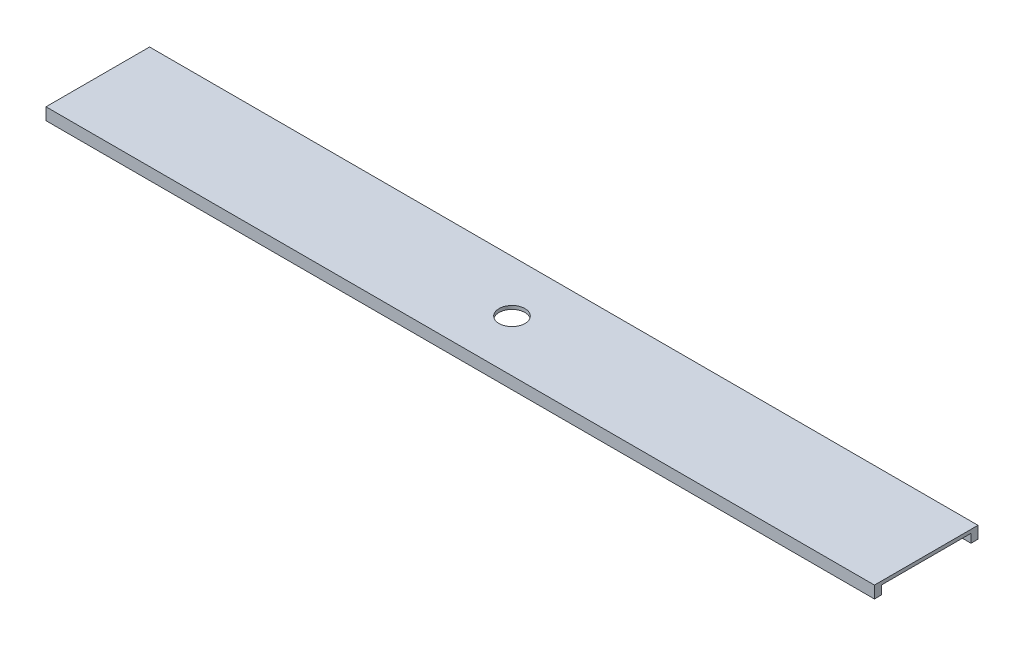
from build123d import *

# Parameters (mm, degrees)
SKETCH1_W               = 960
SKETCH1_H               = 120
BOSS_EXTRUDE1_DEPTH     = 4
CUT_EXTRUDE1_DEPTH      = 24
CUT_EXTRUDE1_DEPTH_BACK = 13
SKETCH2_R               = 15
SKETCH3_W               = 960
SKETCH3_H               = 8.349001696
BOSS_EXTRUDE2_DEPTH     = 10
SKETCH4_W               = 960
SKETCH4_H               = 8.113720408
BOSS_EXTRUDE3_DEPTH     = 10


with BuildPart() as part:
    # Sketch1 → Boss-Extrude1 (new body)
    with BuildSketch(Plane(origin=(0, 0, 0), x_dir=(1, 0, 0), z_dir=(0, 1, 0))):
        Rectangle(SKETCH1_W, SKETCH1_H)
    extrude(amount=BOSS_EXTRUDE1_DEPTH)

    # Sketch2 → Cut-Extrude1 (cut, two sides: drawn at the far end of the back side and taken through both)
    with BuildSketch(Plane(origin=(0, 4, 0), x_dir=(1, 0, 0), z_dir=(0, 1, 0)).offset(-CUT_EXTRUDE1_DEPTH_BACK)):
        with Locations(Location((0, 0, 0), (0, 0, 270))):
            Circle(SKETCH2_R)
    extrude(amount=CUT_EXTRUDE1_DEPTH + CUT_EXTRUDE1_DEPTH_BACK, mode=Mode.SUBTRACT)

    # Sketch3 → Boss-Extrude2 (add)
    with BuildSketch(Plane.XZ):
        with Locations((0, 55.825499152)):
            Rectangle(SKETCH3_W, SKETCH3_H)
    extrude(amount=BOSS_EXTRUDE2_DEPTH)

    # Sketch4 → Boss-Extrude3 (add)
    with BuildSketch(Plane.XZ):
        with Locations((0, -55.943139796)):
            Rectangle(SKETCH4_W, SKETCH4_H)
    extrude(amount=BOSS_EXTRUDE3_DEPTH)


solid = part.part
